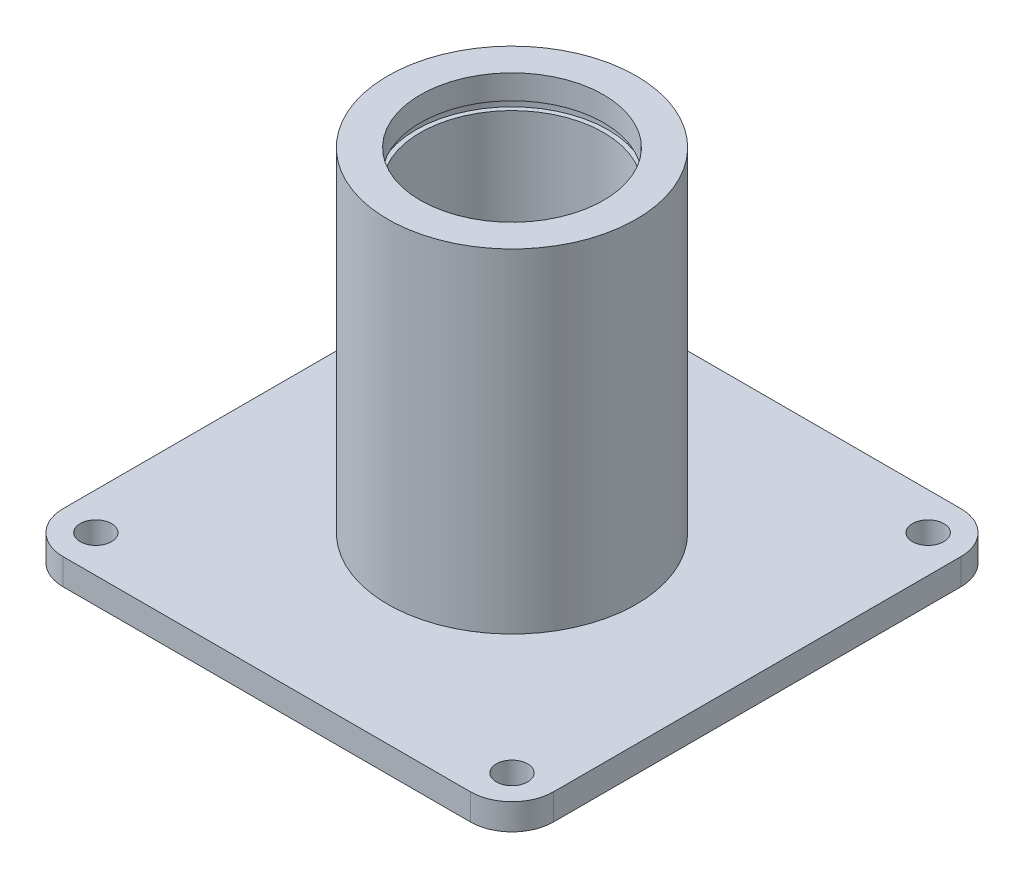
from build123d import *

# Parameters (mm, degrees)
SKETCH2_W                = 75
SKETCH2_H                = 75
SKETCH2_R                = 21
BOSS_EXTRUDE1_DEPTH      = 4
M4_CLEARANCE_HOLE1_D     = 4.8
M4_CLEARANCE_HOLE1_DEPTH = 55
FILLET1_R                = 6.35


with BuildPart() as part:
    # Sketch1 → Revolve1 (revolve)
    with BuildSketch(Plane.XY, mode=Mode.PRIVATE) as revolve1_sk:
        Polygon((-12, 0), (-29, 0), (-29, 4), (-19, 4), (-19, 55), (-14, 55), (-14, 51.3), (-14.7, 51.3), (-14.7, 50), (-14, 50), (-14, 30), (-12, 30), align=None)
    revolve(revolve1_sk.sketch.rotate(Axis((0, 0, 0), (0, 1, 0)), 270), axis=Axis((0, 0, 0), (0, 1, 0)))

    # Sketch2 → Boss-Extrude1 (add)
    with BuildSketch(Plane(origin=(0, 4, 0), x_dir=(1, 0, 0), z_dir=(0, 1, 0))):
        Rectangle(SKETCH2_W, SKETCH2_H)
        Circle(SKETCH2_R, mode=Mode.SUBTRACT)
    extrude(amount=-BOSS_EXTRUDE1_DEPTH)

    # M4 Clearance Hole1
    with Locations(Plane(origin=(0, 0, 0), x_dir=(-1, 0, 0), z_dir=(0, -1, 0))):
        with Locations((0, 0), (-31.819805153, 31.819805153), (31.819805153, 31.819805153), (31.819805153, -31.819805153), (-31.819805153, -31.819805153)):
            Hole(M4_CLEARANCE_HOLE1_D / 2, depth=M4_CLEARANCE_HOLE1_DEPTH)

    # Fillet1
    fillet1_edges = [part.edges().sort_by_distance(p)[0] for p in [
        (37.5, 2, 37.5),
        (37.5, 2, -37.5),
        (-37.5, 2, -37.5),
        (-37.5, 2, 37.5),
    ]]
    fillet(fillet1_edges, radius=FILLET1_R)


solid = part.part
